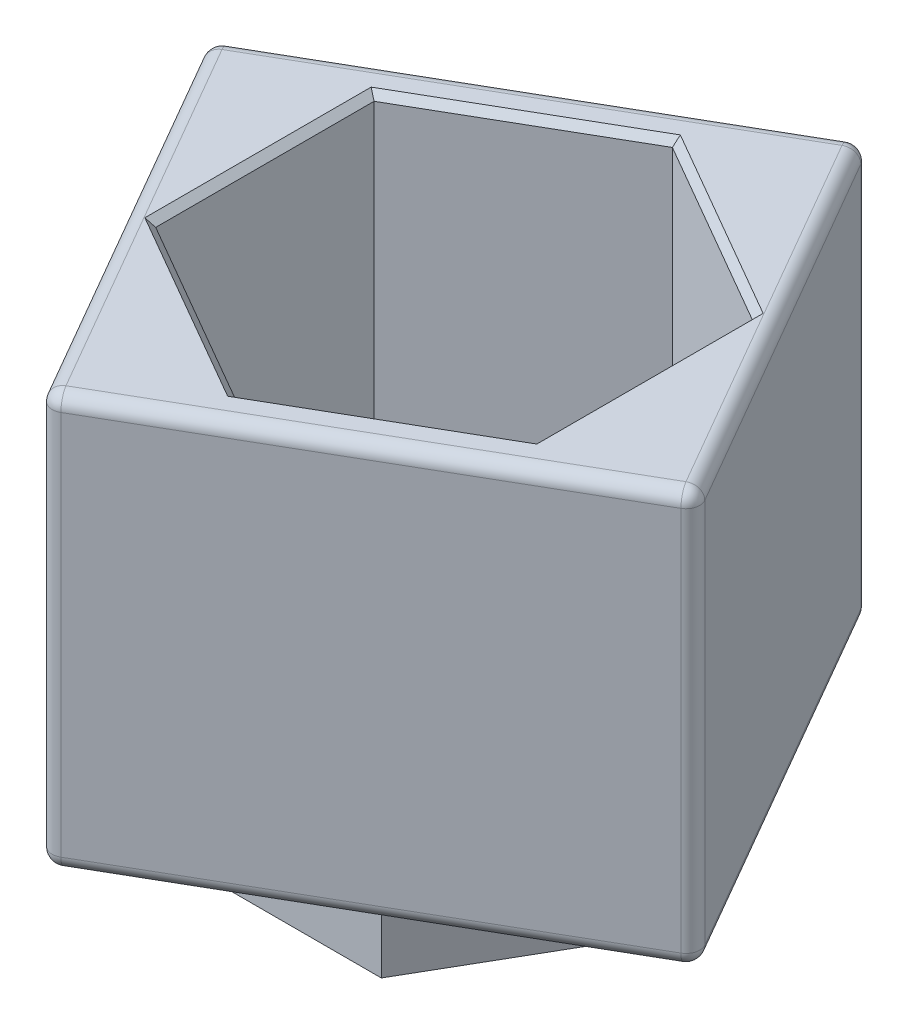
from build123d import *

# Parameters (mm, degrees)
BOSS_EXTRUDE1_DEPTH     = 5
SKETCH4_W               = 50
SKETCH4_H               = 50
BOSS_EXTRUDE2_DEPTH     = 30
CUT_EXTRUDE1_DEPTH      = 25
CUT_EXTRUDE2_DEPTH      = 50.749371855
CUT_EXTRUDE2_DEPTH_BACK = 50.749371855
CUT_EXTRUDE3_DEPTH      = 50.749371855
CUT_EXTRUDE3_DEPTH_BACK = 50.749371855
SKETCH7_W               = 50
SKETCH7_H               = 50
FILLET2_R               = 1
CHAMFER1_SIZE           = 0.5


with BuildPart() as part:
    # Sketch3 → Boss-Extrude1 (new body)
    with BuildSketch(Plane(origin=(0, 0, 0), x_dir=(1, 0, 0), z_dir=(0, 1, 0))):
        Polygon((14.43375673, 0), (7.216878365, 12.5), (-7.216878365, 12.5), (-14.43375673, 0), (-7.216878365, -12.5), (7.216878365, -12.5), align=None)
    extrude(amount=BOSS_EXTRUDE1_DEPTH)

    # Sketch4 → Boss-Extrude2 (add)
    with BuildSketch(Plane(origin=(0, 5, 0), x_dir=(1, 0, 0), z_dir=(0, 1, 0))):
        Rectangle(SKETCH4_W, SKETCH4_H)
    extrude(amount=BOSS_EXTRUDE2_DEPTH)

    # Sketch5 → Cut-Extrude1 (cut)
    with BuildSketch(Plane(origin=(0, 35, 0), x_dir=(1, 0, 0), z_dir=(0, 1, 0))):
        Polygon((0, 15.877132403), (-13.75, 7.938566201), (-13.75, -7.938566201), (0, -15.877132403), (13.75, -7.938566201), (13.75, 7.938566201), align=None)
    extrude(amount=-CUT_EXTRUDE1_DEPTH, mode=Mode.SUBTRACT)

    # Sketch6 → Cut-Extrude2 (cut, two sides: drawn at the far end of the back side and taken through both)
    with BuildSketch(Plane.XZ.offset(-CUT_EXTRUDE2_DEPTH_BACK)):
        Polygon((-12.124355653, 0), (-6.062177826, -10.5), (6.062177826, -10.5), (12.124355653, 0), (6.062177826, 10.5), (-6.062177826, 10.5), align=None)
    extrude(amount=CUT_EXTRUDE2_DEPTH + CUT_EXTRUDE2_DEPTH_BACK, mode=Mode.SUBTRACT)

    # Sketch7 → Cut-Extrude3 (cut, two sides: drawn at the far end of the back side and taken through both)
    with BuildSketch(Plane(origin=(0, 35, 0), x_dir=(1, 0, 0), z_dir=(0, 1, 0)).offset(-CUT_EXTRUDE3_DEPTH_BACK)):
        Rectangle(SKETCH7_W, SKETCH7_H)
        Polygon((-23.405444566, 5.539419162), (6.905444566, 23.039419162), (23.405444566, -5.539419162), (-6.905444566, -23.039419162), align=None, mode=Mode.SUBTRACT)
    extrude(amount=CUT_EXTRUDE3_DEPTH + CUT_EXTRUDE3_DEPTH_BACK, mode=Mode.SUBTRACT)

    # Fillet2
    fillet2_edges = [part.edges().sort_by_distance(p)[0] for p in [
        (-15.155444566, 5, 8.75),
        (-8.25, 5, -14.289419162),
        (15.155444566, 5, -8.75),
        (8.25, 5, 14.289419162),
        (-23.405444566, 20, -5.539419162),
        (-15.155444566, 35, 8.75),
        (6.905444566, 20, -23.039419162),
        (-8.25, 35, -14.289419162),
        (23.405444566, 20, 5.539419162),
        (15.155444566, 35, -8.75),
        (-6.905444566, 20, 23.039419162),
        (8.25, 35, 14.289419162),
    ]]
    fillet(fillet2_edges, radius=FILLET2_R)

    # Chamfer1
    chamfer1_edges = [part.edges().sort_by_distance(p)[0] for p in [
        (6.875, 35, -11.907849302),
        (-6.875, 35, -11.907849302),
        (-13.75, 35, 0),
        (-6.875, 35, 11.907849302),
        (6.875, 35, 11.907849302),
        (13.75, 35, 0),
    ]]
    chamfer(chamfer1_edges, length=CHAMFER1_SIZE)


solid = part.part
